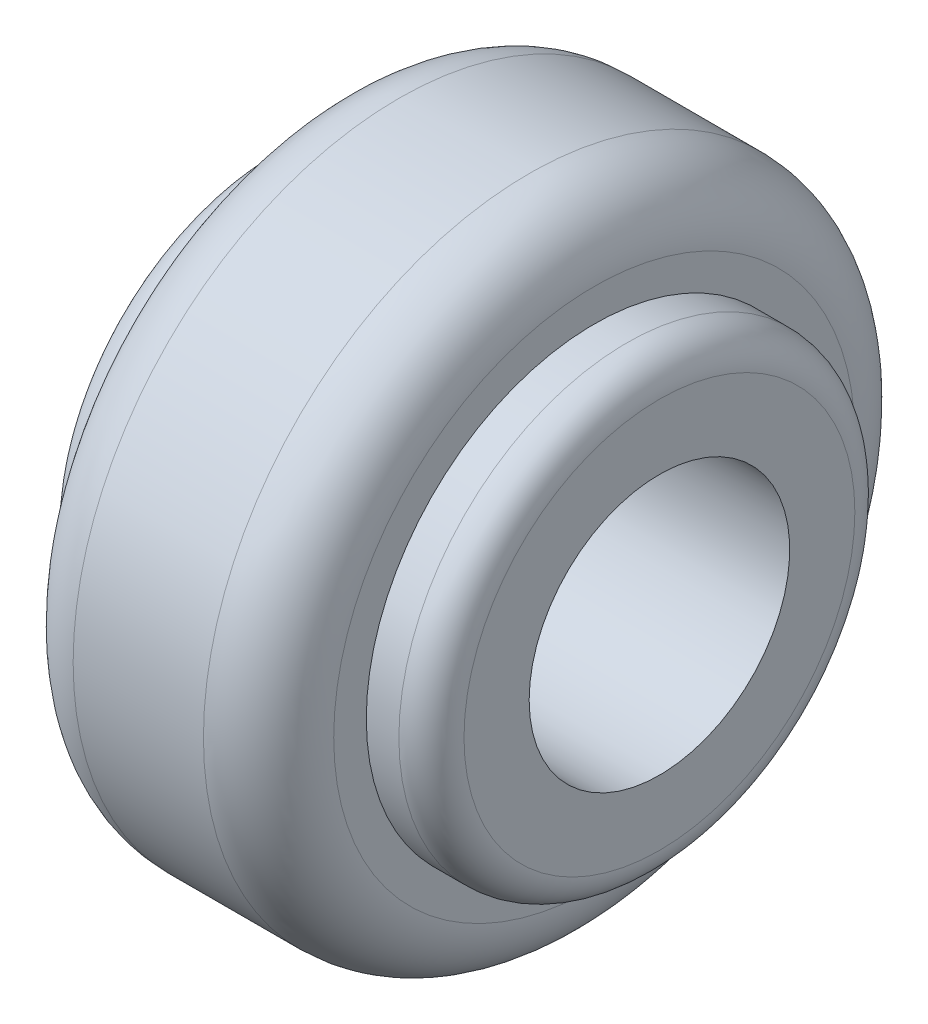
from build123d import *

# Parameters (mm, degrees)
FILLET2_R = 3.175
FILLET3_R = 1.5875


with BuildPart() as part:
    # Sketch2 → Revolve1 (revolve)
    with BuildSketch(Plane(origin=(0, 0, 0), x_dir=(1, 0, 0), z_dir=(0, 1, 0)), mode=Mode.PRIVATE) as revolve1_sk:
        Polygon((0, 6.35), (19.05, 6.35), (19.05, 11.1125), (15.875, 11.1125), (15.875, 15.875), (3.175, 15.875), (3.175, 11.1125), (0, 11.1125), align=None)
    revolve(revolve1_sk.sketch.rotate(Axis((0, 0, 0), (1, 0, 0)), 180), axis=Axis((0, 0, 0), (1, 0, 0)))

    # Fillet2
    fillet2_edges = [part.edges().sort_by_distance(p)[0] for p in [
        (15.875, 0, -15.875),
        (3.175, 0, -15.875),
    ]]
    fillet(fillet2_edges, radius=FILLET2_R)

    # Fillet3
    fillet3_edges = [part.edges().sort_by_distance(p)[0] for p in [
        (19.05, 0, -11.1125),
        (0, 0, -11.1125),
    ]]
    fillet(fillet3_edges, radius=FILLET3_R)


solid = part.part
